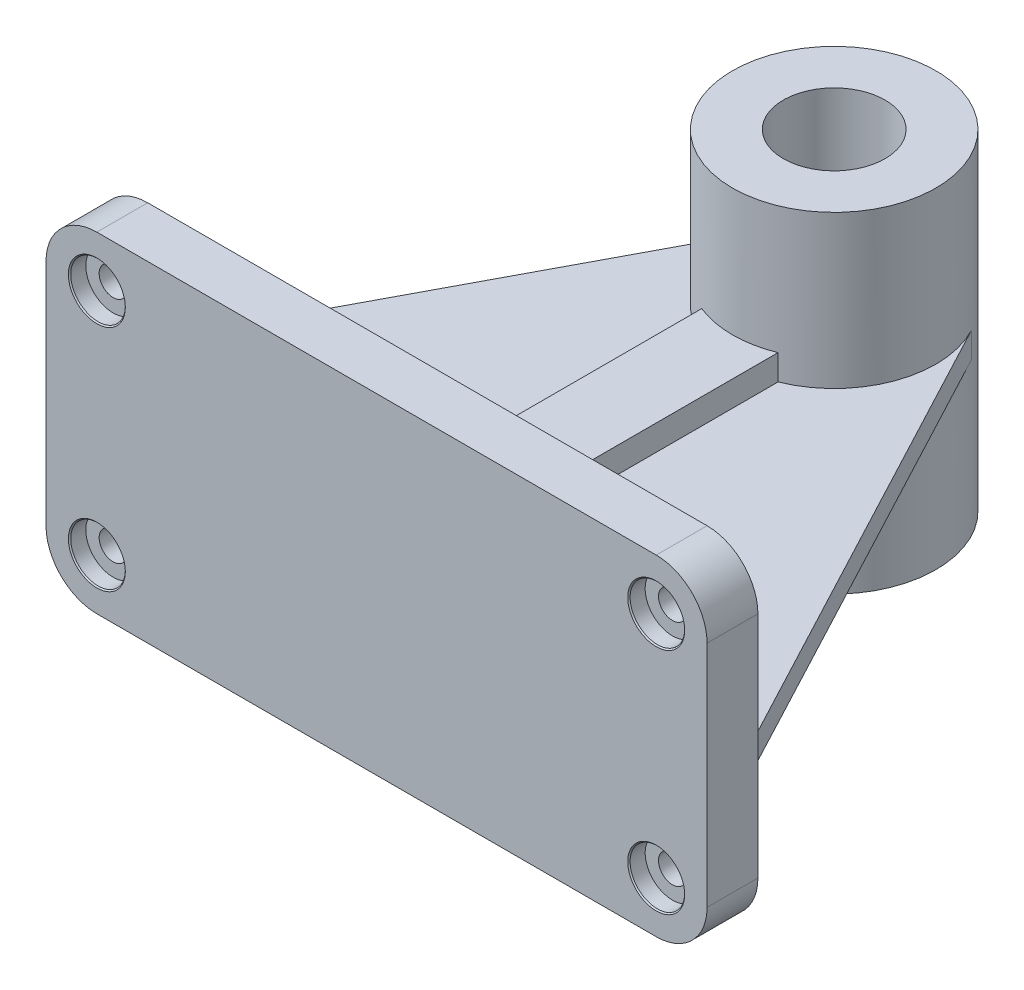
from build123d import *

# Parameters (mm, degrees)
SKETCH_1_W          = 260
SKETCH_1_H          = 130
EXTRUDE_1_DEPTH     = 20
SKETCH_4_R          = 40
EXTRUDE_2_DEPTH     = 65
EXTRUDE_3_DEPTH     = 15
RIB_4_REACH         = 249.235
SKETCH_6_WALL_W     = 698.706896764
SKETCH_6_WALL_H     = 10
SKETCH_7_R          = 20
CUT_EXTRUDE_1_DEPTH = 272.661554144
FILLET_1_R          = 20


with BuildPart() as part:
    # 草图1 → 凸台-拉伸1 (new body)
    with BuildSketch(Plane.XY):
        Rectangle(SKETCH_1_W, SKETCH_1_H)
    extrude(amount=EXTRUDE_1_DEPTH)

    # 草图3 → M10 六角头螺栓的柱形沉头孔1 (revolve, cut)
    with BuildSketch(Plane(origin=(-110, 45, 20), x_dir=(0, -1, 0), z_dir=(1, 0, 0))):
        Polygon((0, 0), (0, 30.804733405), (5.5, 27.5), (5.5, 6.4), (10.7375, 6.4), (10.7375, 0.4625), (11.2, 0), align=None)
    hole_wizard_m10_1 = revolve(axis=Axis((-110, 45, 26.35), (0, 0, -1)), mode=Mode.SUBTRACT)

    # 镜向1: M10 六角头螺栓的柱形沉头孔1 across plane
    add(hole_wizard_m10_1.mirror(Plane.ZX), mode=Mode.SUBTRACT)

    # 镜向2: M10 六角头螺栓的柱形沉头孔1 across plane
    add(hole_wizard_m10_1.mirror(Plane(origin=(0, 0, 0), x_dir=(0, 0, 1), z_dir=(1, 0, 0))), mode=Mode.SUBTRACT)

    # 镜向2 copy 1 sketch → 镜向2 copy 1 (revolve, cut)
    with BuildSketch(Plane(origin=(110, -45, 20), x_dir=(0, 1, 0), z_dir=(-1, 0, 0))):
        Polygon((0, 0), (0, 30.804733405), (5.5, 27.5), (5.5, 6.4), (10.7375, 6.4), (10.7375, 0.4625), (11.2, 0), align=None)
    revolve(axis=Axis((110, -45, 26.35), (0, 0, -1)), mode=Mode.SUBTRACT)



with BuildPart() as body_2:
    # 草图4 → 凸台-拉伸2 (new, symmetric)
    with BuildSketch(Plane(origin=(0, 0, 0), x_dir=(1, 0, 0), z_dir=(0, 1, 0))):
        with Locations(Location((0, 160, 0), (0, 0, 270))):
            Circle(SKETCH_4_R)
    extrude(amount=EXTRUDE_2_DEPTH, both=True)


with BuildPart() as part_1:
    add(part.part)

    add(body_2.part)  # 凸台-拉伸3 merges body 2
    # 草图5 → 凸台-拉伸3 (add, symmetric)
    with BuildSketch(Plane(origin=(0, 0, 0), x_dir=(1, 0, 0), z_dir=(0, 1, 0))):
        with BuildLine():
            Line((-15, 122.919007565), (-15, 0))
            Line((-15, 0), (15, 0))
            Line((15, 0), (15, 122.919007565))
            ThreePointArc((15, 122.919007565), (0, 120), (-15, 122.919007565))
        make_face()
    extrude(amount=EXTRUDE_3_DEPTH, both=True)

    # 草图6 wall → 筋4 (add, up to next)
    with BuildSketch(Plane(origin=(82.674351749, 0, -89.360410796), x_dir=(-0.468020539788, 0, -0.883717587432), z_dir=(-0.883717587432, 0, 0.468020539788)), mode=Mode.PRIVATE) as rib_4_sk1:
        Rectangle(SKETCH_6_WALL_W, SKETCH_6_WALL_H)
    rib_4_tool1 = extrude(rib_4_sk1.sketch, amount=RIB_4_REACH, mode=Mode.PRIVATE) - part_1.part
    rib_4 = rib_4_tool1.solids().sort_by_distance((82.674351749, 0, -89.360410796))[0]
    add(rib_4)

    # 镜向3: 筋4 across plane
    add(rib_4.mirror(Plane(origin=(0, 0, 0), x_dir=(0, 0, 1), z_dir=(1, 0, 0))))

    # 草图7 → 切除-拉伸1 (cut, through all)
    with BuildSketch(Plane(origin=(0, 65, 0), x_dir=(1, 0, 0), z_dir=(0, 1, 0))):
        with Locations(Location((0, 160, 0), (0, 0, 270))):
            Circle(SKETCH_7_R)
    extrude(amount=-CUT_EXTRUDE_1_DEPTH, mode=Mode.SUBTRACT)

    # 圆角1
    fillet_1_edges = [part_1.edges().sort_by_distance(p)[0] for p in [
        (-130, 65, 10),
        (130, 65, 10),
        (130, -65, 10),
        (-130, -65, 10),
    ]]
    fillet(fillet_1_edges, radius=FILLET_1_R)


solid = part_1.part
